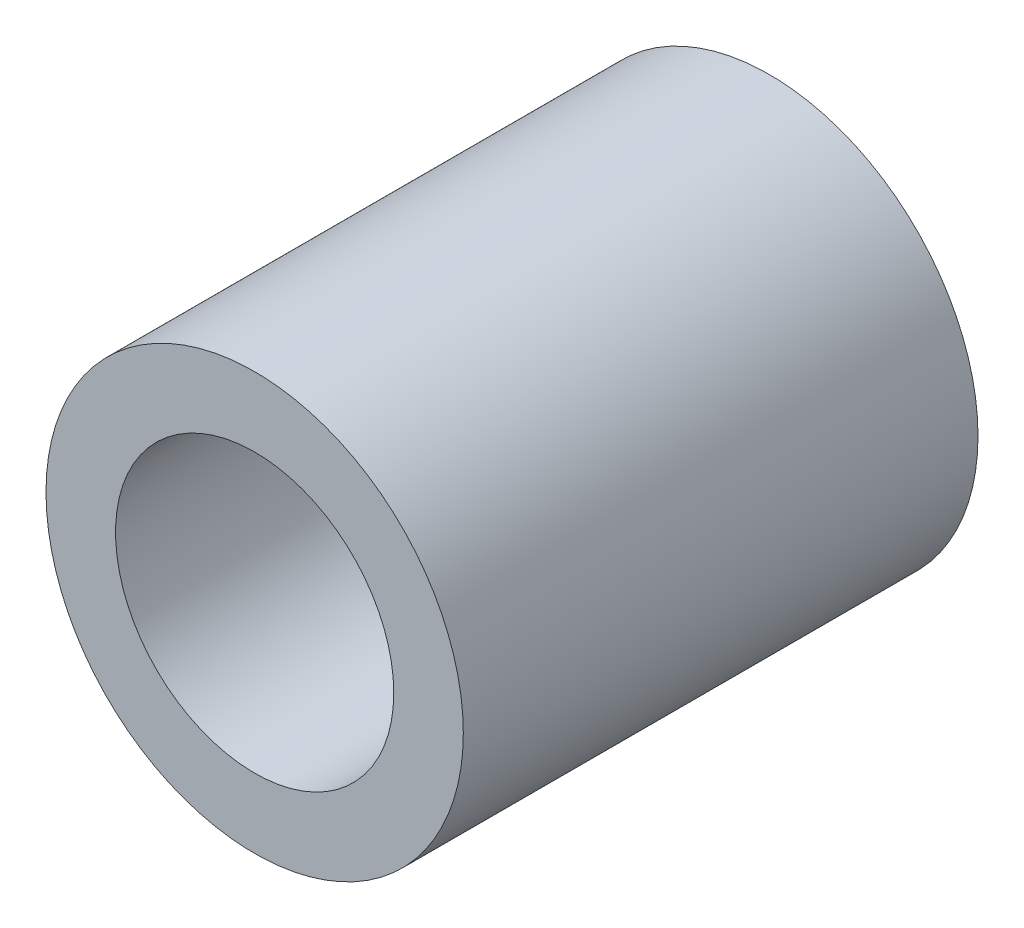
from build123d import *

# Parameters (mm, degrees)
SKETCH1_R           = 2.38125
SKETCH1_R_2         = 1.5875
BOSS_EXTRUDE1_DEPTH = 5.87375


with BuildPart() as part:
    # Sketch1 → Boss-Extrude1 (new body)
    with BuildSketch(Plane.XY):
        Circle(SKETCH1_R)
        Circle(SKETCH1_R_2, mode=Mode.SUBTRACT)
    extrude(amount=BOSS_EXTRUDE1_DEPTH)


solid = part.part
